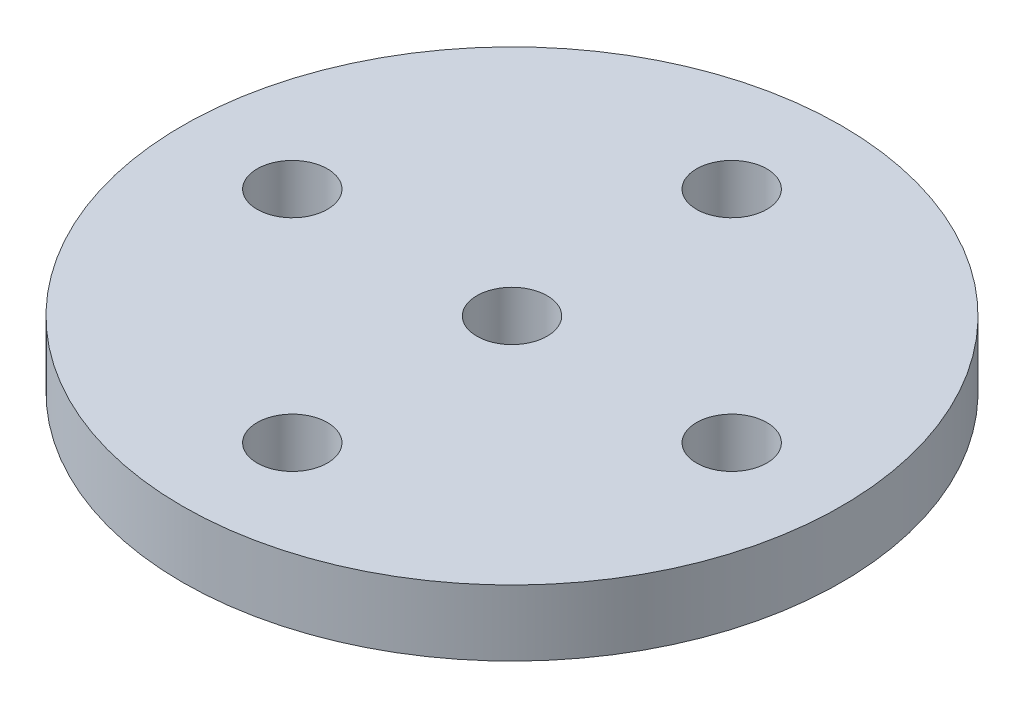
from build123d import *

# Parameters (mm, degrees)
SKETCH1_R           = 15
SKETCH1_R_2         = 1.6
BOSS_EXTRUDE1_DEPTH = 3


with BuildPart() as part:
    # Sketch1 → Boss-Extrude1 (new body)
    with BuildSketch(Plane(origin=(0, 0, 0), x_dir=(1, 0, 0), z_dir=(0, 1, 0))):
        Circle(SKETCH1_R)
        Circle(SKETCH1_R_2, mode=Mode.SUBTRACT)
        with Locations((0, 10)):
            Circle(SKETCH1_R_2, mode=Mode.SUBTRACT)
        with Locations((10, 0)):
            Circle(SKETCH1_R_2, mode=Mode.SUBTRACT)
        with Locations((0, -10)):
            Circle(SKETCH1_R_2, mode=Mode.SUBTRACT)
        with Locations((-10, 0)):
            Circle(SKETCH1_R_2, mode=Mode.SUBTRACT)
    extrude(amount=BOSS_EXTRUDE1_DEPTH)


solid = part.part
